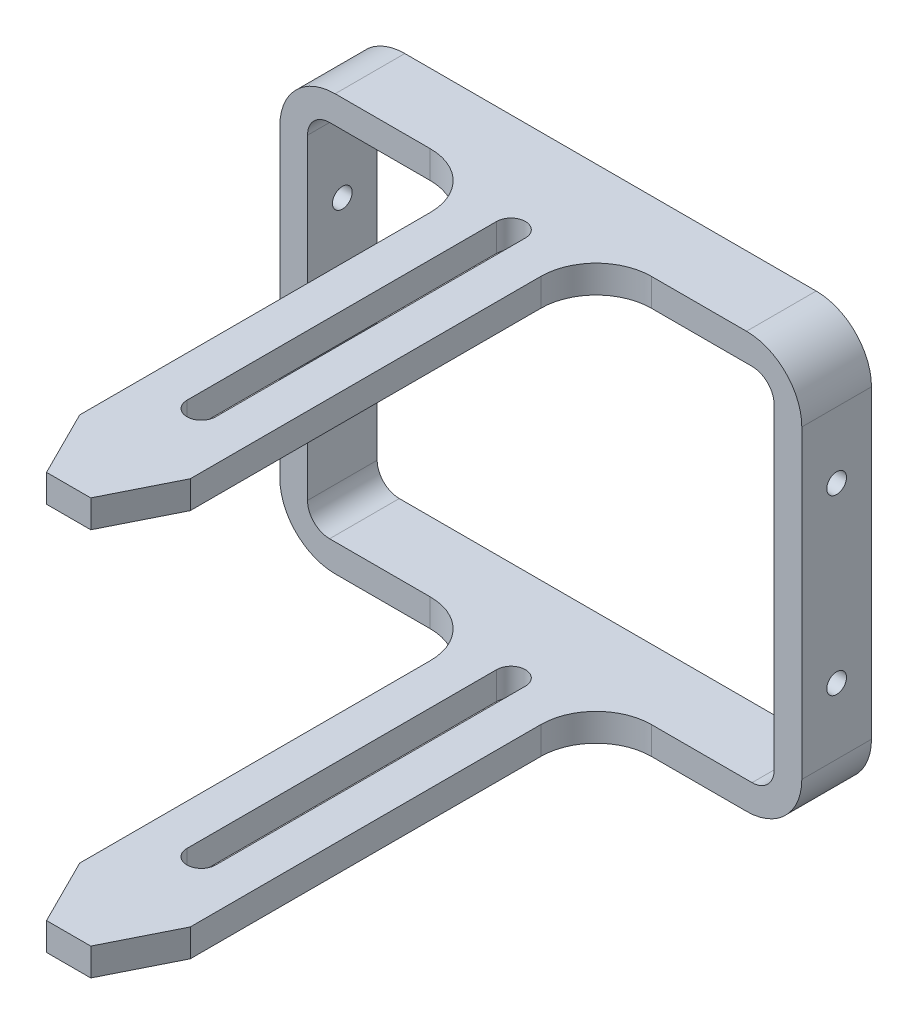
from build123d import *

# Parameters (mm, degrees)
SKETCH1_W             = 59.944
SKETCH1_H             = 47.752
SKETCH1_W_2           = 53.594
SKETCH1_H_2           = 41.402
BOSS_EXTRUDE1_DEPTH   = 8.001
BOSS_EXTRUDE2_DEPTH   = 3.175
CUT_EXTRUDE1_DEPTH    = 3.302
F_4_40_TAPPED_HOLE1_D = 2.2606
FILLET1_R             = 6.35
FILLET2_R             = 2.54
FILLET3_R             = 6.35


with BuildPart() as part:
    # Sketch1 → Boss-Extrude1 (new body)
    with BuildSketch(Plane.XY):
        Rectangle(SKETCH1_W, SKETCH1_H)
        Rectangle(SKETCH1_W_2, SKETCH1_H_2, mode=Mode.SUBTRACT)
    extrude(amount=BOSS_EXTRUDE1_DEPTH)

    # Sketch2 → Boss-Extrude2 (add)
    with BuildSketch(Plane(origin=(0, 23.876, 0), x_dir=(1, 0, 0), z_dir=(0, 1, 0))):
        Polygon((-6.35, -8.001), (-6.35, -54.61), (-2.54, -62.23), (2.54, -62.23), (6.35, -54.61), (6.35, -8.001), align=None)
    boss_extrude2 = extrude(amount=-BOSS_EXTRUDE2_DEPTH)

    # Sketch3 → Cut-Extrude1 (cut)
    with BuildSketch(Plane(origin=(0, 23.876, 0), x_dir=(1, 0, 0), z_dir=(0, 1, 0))):
        with BuildLine():
            Line((-1.651, -46.99), (-1.651, -11.43))
            ThreePointArc((-1.651, -11.43), (0, -9.779), (1.651, -11.43))
            Line((1.651, -11.43), (1.651, -46.99))
            ThreePointArc((1.651, -46.99), (0, -48.641), (-1.651, -46.99))
        make_face()
    cut_extrude1 = extrude(amount=-CUT_EXTRUDE1_DEPTH, mode=Mode.SUBTRACT)

    # Mirror1: Boss-Extrude2, Cut-Extrude1 across plane
    add(boss_extrude2.mirror(Plane.ZX))
    add(cut_extrude1.mirror(Plane.ZX), mode=Mode.SUBTRACT)

    # #4-40 Tapped Hole1 (through all)
    with Locations(Plane.ZY.offset(29.972)):
        with Locations((4.0005, 9.9441), (4.0005, -9.9441)):
            Hole(F_4_40_TAPPED_HOLE1_D / 2)

    # Fillet1
    fillet1_edges = [part.edges().sort_by_distance(p)[0] for p in [
        (29.972, -23.876, 4.0005),
        (-29.972, -23.876, 4.0005),
        (-29.972, 23.876, 4.0005),
        (29.972, 23.876, 4.0005),
    ]]
    fillet(fillet1_edges, radius=FILLET1_R)

    # Fillet2
    fillet2_edges = [part.edges().sort_by_distance(p)[0] for p in [
        (26.797, -20.701, 4.0005),
        (26.797, 20.701, 4.0005),
        (-26.797, 20.701, 4.0005),
        (-26.797, -20.701, 4.0005),
    ]]
    fillet(fillet2_edges, radius=FILLET2_R)

    # Fillet3
    fillet3_edges = [part.edges().sort_by_distance(p)[0] for p in [
        (-6.35, 22.2885, 8.001),
        (6.35, 22.2885, 8.001),
        (-6.35, -22.2885, 8.001),
        (6.35, -22.2885, 8.001),
    ]]
    fillet(fillet3_edges, radius=FILLET3_R)


solid = part.part
